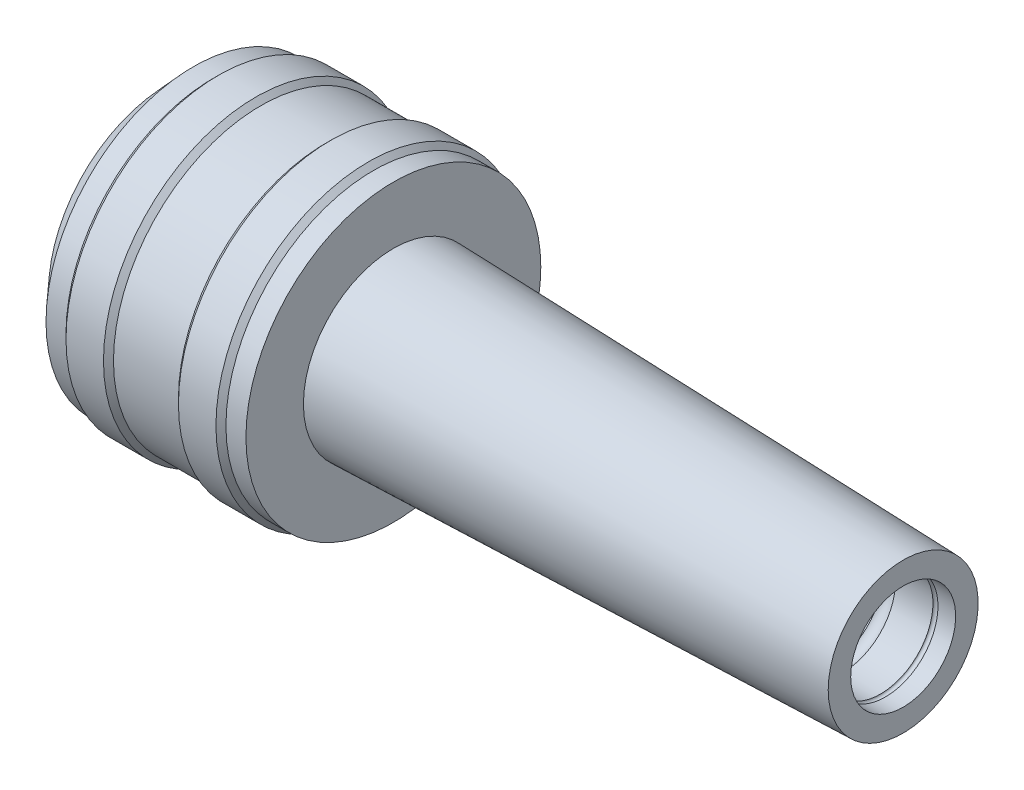
from build123d import *


with BuildPart() as part:
    # Sketch1 → Revolve1 (revolve)
    with BuildSketch(Plane.XY, mode=Mode.PRIVATE) as revolve1_sk:
        with BuildLine():
            Line((-69.541046611, 59), (-61.541046611, 59))
            Line((-61.541046611, 59), (-59.541046611, 61))
            Line((-59.541046611, 61), (-44.541046611, 61))
            Line((-44.541046611, 61), (-42.541046611, 59))
            Line((-42.541046611, 59), (-16.541046611, 59))
            Line((-16.541046611, 59), (-14.541046611, 61))
            Line((-14.541046611, 61), (0.458953389, 61))
            Line((0.458953389, 61), (2.458953389, 59))
            Line((2.458953389, 59), (10.458953389, 59))
            Line((10.458953389, 59), (10.458953389, 36))
            Line((10.458953389, 36), (214.458953389, 30))
            Line((214.458953389, 30), (214.458953389, 21))
            Line((214.458953389, 21), (207.378173445, 21))
            ThreePointArc((207.378173445, 21), (206.378173445, 21.742044507), (205.378173445, 21))
            Line((205.378173445, 21), (190.378173445, 21))
            ThreePointArc((190.378173445, 21), (187.878173445, 22.035533906), (185.378173445, 21))
            Line((185.378173445, 21), (-1.541046611, 21))
            Line((-1.541046611, 21), (-1.541046611, 42))
            Line((-1.541046611, 42), (-29.541046611, 42))
            Line((-29.541046611, 42), (-29.541046611, 49.65729462))
            Line((-29.541046611, 49.65729462), (-33.541046611, 49.65729462))
            Line((-33.541046611, 49.65729462), (-33.541046611, 48))
            Line((-33.541046611, 48), (-79.541046611, 48))
            Line((-79.541046611, 48), (-69.541046611, 59))
        make_face()
    revolve(revolve1_sk.sketch.rotate(Axis((-185.161107322, 0, 0), (1, 0, 0)), 90), axis=Axis((-185.161107322, 0, 0), (1, 0, 0)))


solid = part.part
